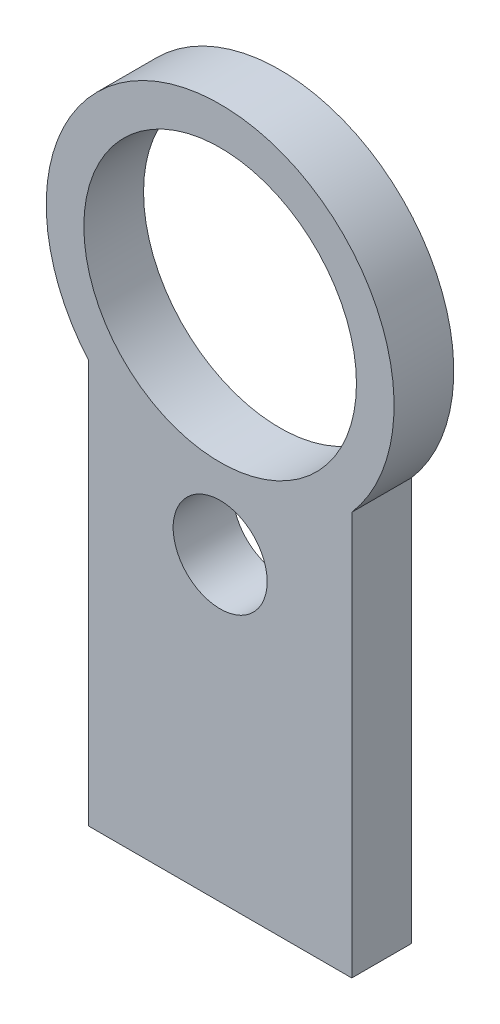
from build123d import *

# Parameters (mm, degrees)
SKETCH1_R           = 14.5
SKETCH1_R_2         = 5
BOSS_EXTRUDE1_DEPTH = 6.35


with BuildPart() as part:
    # Sketch1 → Boss-Extrude1 (new body)
    with BuildSketch(Plane.XY):
        with BuildLine():
            Line((-14, -55), (14, -55))
            Line((14, -55), (14, -12.093386622))
            ThreePointArc((14, -12.093386622), (0, 18.5), (-14, -12.093386622))
            Line((-14, -12.093386622), (-14, -55))
        make_face()
        Circle(SKETCH1_R, mode=Mode.SUBTRACT)
        with Locations((0, -23)):
            Circle(SKETCH1_R_2, mode=Mode.SUBTRACT)
    extrude(amount=BOSS_EXTRUDE1_DEPTH)


solid = part.part
